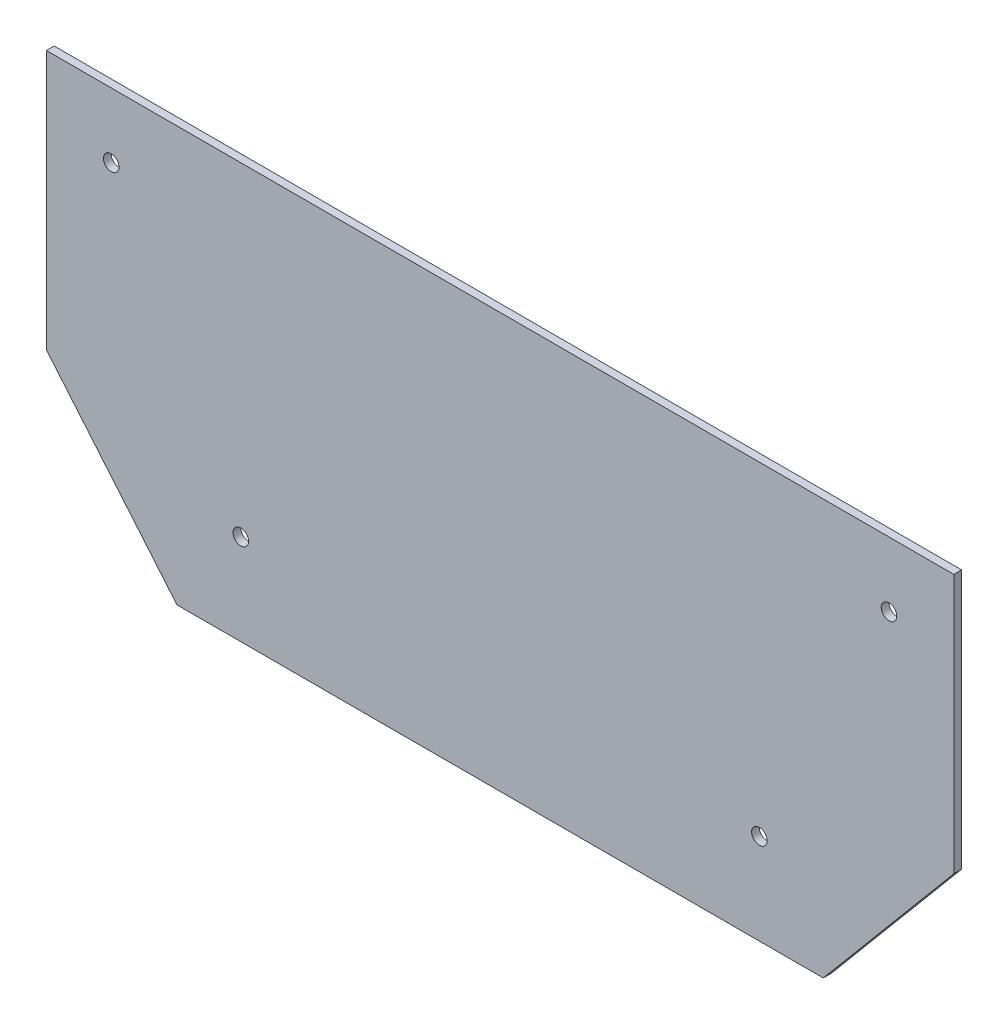
from build123d import *

# Parameters (mm, degrees)
SKETCH1_R           = 1.5
BOSS_EXTRUDE1_DEPTH = 1.5


with BuildPart() as part:
    # Sketch1 → Boss-Extrude1 (new body)
    with BuildSketch(Plane.XY):
        Polygon((-87.5, 40), (87.5, 40), (87.5, -10), (62.327011065, -40), (-62.327011065, -40), (-87.5, -10), align=None)
        with Locations((-75, 27.5)):
            Circle(SKETCH1_R, mode=Mode.SUBTRACT)
        with Locations((-50, -22.5)):
            Circle(SKETCH1_R, mode=Mode.SUBTRACT)
        with Locations((50, -22.5)):
            Circle(SKETCH1_R, mode=Mode.SUBTRACT)
        with Locations((75, 27.5)):
            Circle(SKETCH1_R, mode=Mode.SUBTRACT)
    extrude(amount=BOSS_EXTRUDE1_DEPTH)


solid = part.part
